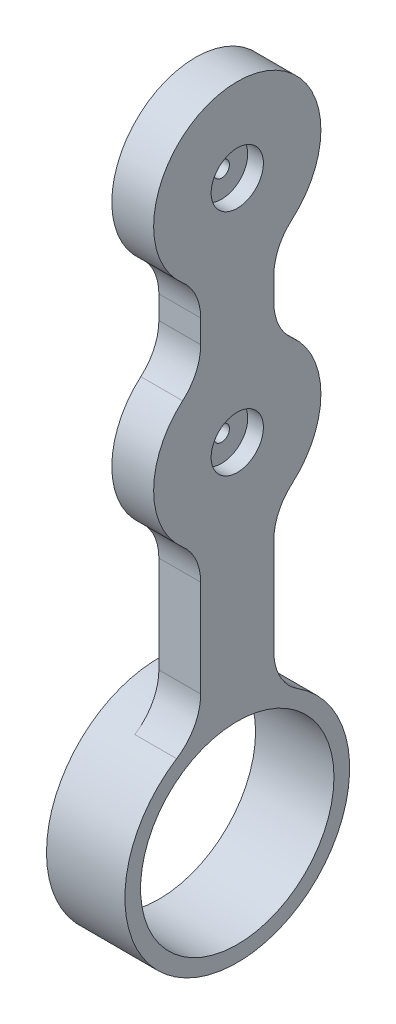
from build123d import *

# Parameters (mm, degrees)
BOSS_EXTRUDE1_DEPTH      = 4
BOSS_EXTRUDE1_DEPTH_BACK = 4
FILLET1_R                = 10
SKETCH2_R                = 5
CUT_EXTRUDE1_DEPTH       = 3
SKETCH3_R                = 1.5
CUT_EXTRUDE2_DEPTH       = 5
SKETCH4_R                = 18.5
CUT_EXTRUDE3_DEPTH       = 8
SKETCH5_R                = 21.5
SKETCH5_R_2              = 18.5
BOSS_EXTRUDE2_DEPTH      = 7


with BuildPart() as part:
    # Sketch1 → Boss-Extrude1 (new, two sides: drawn at the far end of the back side and taken through both)
    with BuildSketch(Plane(origin=(0, 0, 0), x_dir=(0, 0, -1), z_dir=(1, 0, 0)).offset(-BOSS_EXTRUDE1_DEPTH_BACK)):
        with BuildLine():
            Line((-7, -14.38749457), (-7, -29.38749457))
            ThreePointArc((-7, -29.38749457), (-16, -43.77498914), (-7, -58.16248371))
            Line((-7, -58.16248371), (-7, -88.16248371))
            ThreePointArc((-7, -88.16248371), (0, -129.99103506), (7, -88.16248371))
            Line((7, -88.16248371), (7, -58.16248371))
            ThreePointArc((7, -58.16248371), (16, -43.77498914), (7, -29.38749457))
            Line((7, -29.38749457), (7, -14.38749457))
            ThreePointArc((7, -14.38749457), (0, 16), (-7, -14.38749457))
        make_face()
    extrude(amount=BOSS_EXTRUDE1_DEPTH + BOSS_EXTRUDE1_DEPTH_BACK)

    # Fillet1
    fillet1_edges = [part.edges().sort_by_distance(p)[0] for p in [
        (0, -29.38749457, 7),
        (0, -14.38749457, 7),
        (0, -14.38749457, -7),
        (0, -29.38749457, -7),
        (0, -58.16248371, -7),
        (0, -88.16248371, -7),
        (0, -88.16248371, 7),
        (0, -58.16248371, 7),
    ]]
    fillet(fillet1_edges, radius=FILLET1_R)

    # Sketch2 → Cut-Extrude1 (cut)
    with BuildSketch(Plane(origin=(4, 0, 0), x_dir=(0, 0, -1), z_dir=(1, 0, 0))):
        Circle(SKETCH2_R)
        with Locations((0, -43.77498914)):
            Circle(SKETCH2_R)
    extrude(amount=-CUT_EXTRUDE1_DEPTH, mode=Mode.SUBTRACT)

    # Sketch3 → Cut-Extrude2 (cut)
    with BuildSketch(Plane(origin=(1, 0, 0), x_dir=(0, 0, -1), z_dir=(1, 0, 0))):
        Circle(SKETCH3_R)
        with Locations((0, -43.77498914)):
            Circle(SKETCH3_R)
    extrude(amount=-CUT_EXTRUDE2_DEPTH, mode=Mode.SUBTRACT)

    # Sketch4 → Cut-Extrude3 (cut)
    with BuildSketch(Plane(origin=(4, 0, 0), x_dir=(0, 0, -1), z_dir=(1, 0, 0))):
        with Locations((0, -108.49103506)):
            Circle(SKETCH4_R)
    extrude(amount=-CUT_EXTRUDE3_DEPTH, mode=Mode.SUBTRACT)

    # Sketch5 → Boss-Extrude2 (add)
    with BuildSketch(Plane.ZY.offset(4)):
        with Locations(Location((0, -108.49103506, 0), (0, 0, 122.662030563))):
            Circle(SKETCH5_R)
        with Locations(Location((0, -108.49103506, 0), (0, 0, 180))):
            Circle(SKETCH5_R_2, mode=Mode.SUBTRACT)
    extrude(amount=BOSS_EXTRUDE2_DEPTH)


solid = part.part
